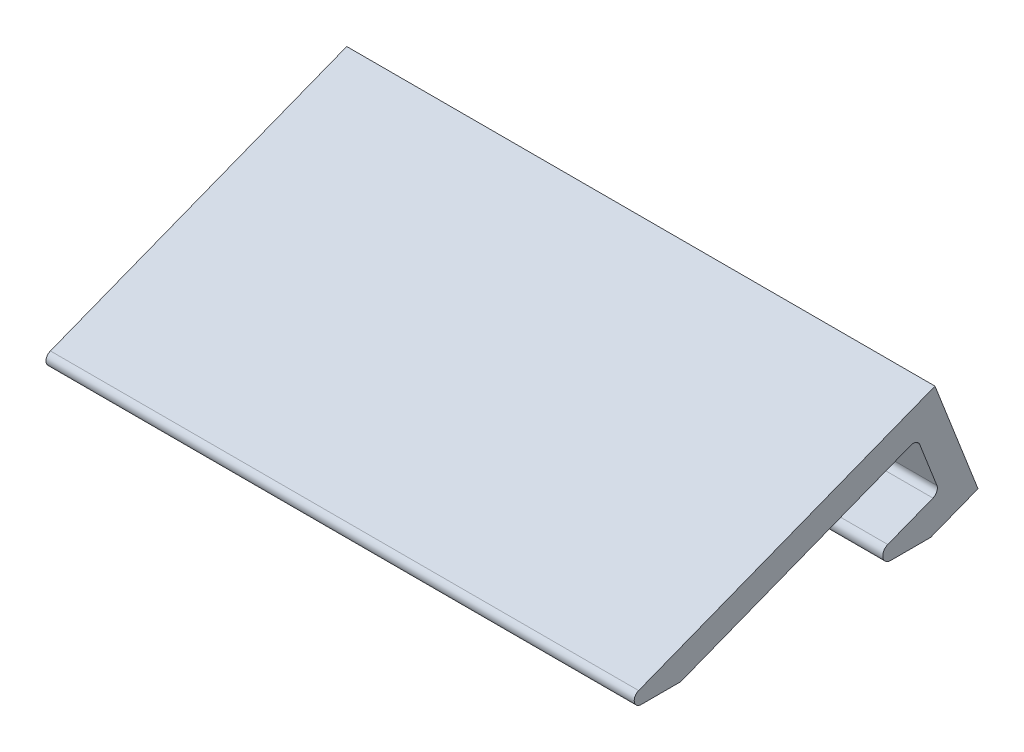
from build123d import *

# Parameters (mm, degrees)
AUFSATZ_LINEAR_AUSTRAGEN1_DEPTH = 849


with BuildPart() as part:
    # Skizze1 → Aufsatz-Linear austragen1 (new body)
    with BuildSketch(Plane(origin=(0, 0, 0), x_dir=(0, 0, -1), z_dir=(1, 0, 0))):
        with BuildLine():
            Line((49.569106164, 19.317466899), (477.280680476, 186))
            Line((477.280680476, 186), (539.372310058, 26.671316029))
            Line((539.372310058, 26.671316029), (470.933041974, 0))
            Line((470.933041974, 0), (413.328001817, 0))
            ThreePointArc((413.328001817, 0), (402.093085354, 9.319853414), (409.17705944, 22.083094646))
            Line((409.17705944, 22.083094646), (474.376050862, 47.491649613))
            ThreePointArc((474.376050862, 47.491649613), (479.900973413, 52.788240457), (480.062428312, 60.440205962))
            Line((480.062428312, 60.440205962), (455.371020057, 123.798980874))
            ThreePointArc((455.371020057, 123.798980874), (450.074429213, 129.323903425), (442.422463709, 129.485358324))
            Line((442.422463709, 129.485358324), (110.1597759, 0))
            Line((110.1597759, 0), (53.200195614, 0))
            ThreePointArc((53.200195614, 0), (43.372310058, 8.152659884), (49.569106164, 19.317466899))
        make_face()
    extrude(amount=AUFSATZ_LINEAR_AUSTRAGEN1_DEPTH)


solid = part.part
